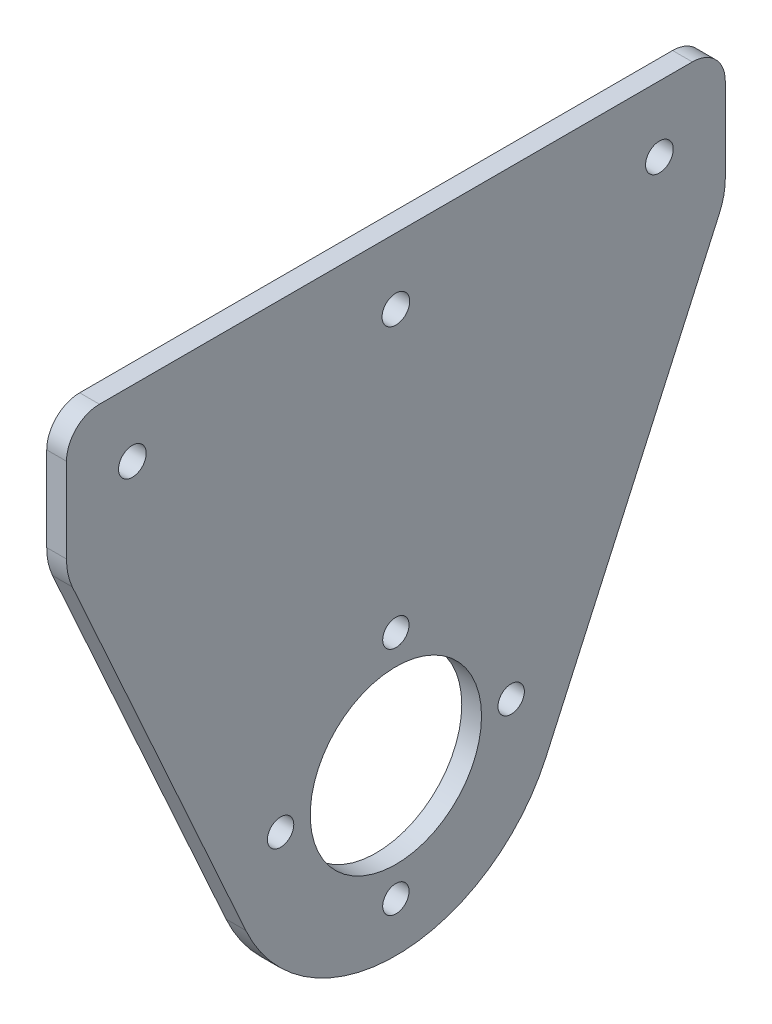
from build123d import *

# Parameters (mm, degrees)
SKETCH_1_R          = 25
SKETCH_1_R_2        = 13
EXTRUDE_1_DEPTH     = 3
SKETCH_2_R          = 2
CUT_EXTRUDE_1_DEPTH = 3
EXTRUDE_START       = -3
EXTRUDE_2_DEPTH     = 3
SKETCH_4_W          = 100
SKETCH_4_H          = 20
EXTRUDE_3_DEPTH     = 3
EXTRUDE_4_DEPTH     = 3
SKETCH_6_R          = 2.1
CUT_EXTRUDE_2_DEPTH = 87.075548212
FILLET_1_R          = 5
FILLET_2_R          = 10


with BuildPart() as part:
    # 草图1 → 凸台-拉伸1 (new body)
    with BuildSketch(Plane(origin=(0, 0, 0), x_dir=(0, 0, -1), z_dir=(1, 0, 0))):
        Circle(SKETCH_1_R)
        Circle(SKETCH_1_R_2, mode=Mode.SUBTRACT)
    extrude(amount=EXTRUDE_1_DEPTH)

    # 草图2 → 切除-拉伸1 (cut)
    with BuildSketch(Plane(origin=(3, 0, 0), x_dir=(0, 0, -1), z_dir=(1, 0, 0))):
        with Locations((0, 17.5)):
            Circle(SKETCH_2_R)
        with Locations((17.5, 0)):
            Circle(SKETCH_2_R)
        with Locations((0, -17.5)):
            Circle(SKETCH_2_R)
        with Locations((-17.5, 0)):
            Circle(SKETCH_2_R)
    extrude(amount=-CUT_EXTRUDE_1_DEPTH, mode=Mode.SUBTRACT)

    # 草图3 → 凸台-拉伸2 (add)
    with BuildSketch(Plane(origin=(3, 0, 0), x_dir=(0, 0, -1), z_dir=(1, 0, 0)).offset(EXTRUDE_START)):
        with BuildLine():
            Line((-25, 0), (-25, 70))
            Line((-25, 70), (25, 70))
            Line((25, 70), (25, 0))
            ThreePointArc((25, 0), (0, 25), (-25, 0))
        make_face()
    extrude(amount=EXTRUDE_2_DEPTH)

    # 草图4 → 凸台-拉伸3 (add)
    with BuildSketch(Plane(origin=(3, 0, 0), x_dir=(0, 0, -1), z_dir=(1, 0, 0))):
        with Locations((0, 60)):
            Rectangle(SKETCH_4_W, SKETCH_4_H)
    extrude(amount=-EXTRUDE_3_DEPTH)

    # 草图5 → 凸台-拉伸4 (add)
    with BuildSketch(Plane(origin=(3, 0, 0), x_dir=(0, 0, -1), z_dir=(1, 0, 0)).offset(EXTRUDE_START)):
        with BuildLine():
            Line((-22.785945694, -10.285945694), (-50, 50))
            Line((-50, 50), (-25, 50))
            Line((-25, 50), (-25, 0))
            ThreePointArc((-25, 0), (-24.440219336, -5.260767893), (-22.785945694, -10.285945694))
        make_face()
        with BuildLine():
            Line((22.785945694, -10.285945694), (50, 50))
            Line((50, 50), (25, 50))
            Line((25, 50), (25, 0))
            ThreePointArc((25, 0), (24.440219336, -5.260767893), (22.785945694, -10.285945694))
        make_face()
    extrude(amount=EXTRUDE_4_DEPTH)

    # 草图6 → 切除-拉伸2 (cut, through all)
    with BuildSketch(Plane(origin=(3, 0, 0), x_dir=(0, 0, -1), z_dir=(1, 0, 0))):
        with Locations((-40, 60)):
            Circle(SKETCH_6_R)
        with Locations((0, 60)):
            Circle(SKETCH_6_R)
        with Locations((40, 60)):
            Circle(SKETCH_6_R)
    extrude(amount=-CUT_EXTRUDE_2_DEPTH, mode=Mode.SUBTRACT)

    # 圆角1
    fillet_1_edges = [part.edges().sort_by_distance(p)[0] for p in [
        (1.5, 70, 50),
        (1.5, 70, -50),
    ]]
    fillet(fillet_1_edges, radius=FILLET_1_R)

    # 圆角2
    fillet_2_edges = [part.edges().sort_by_distance(p)[0] for p in [
        (1.5, 50, 50),
        (1.5, 50, -50),
    ]]
    fillet(fillet_2_edges, radius=FILLET_2_R)


solid = part.part
